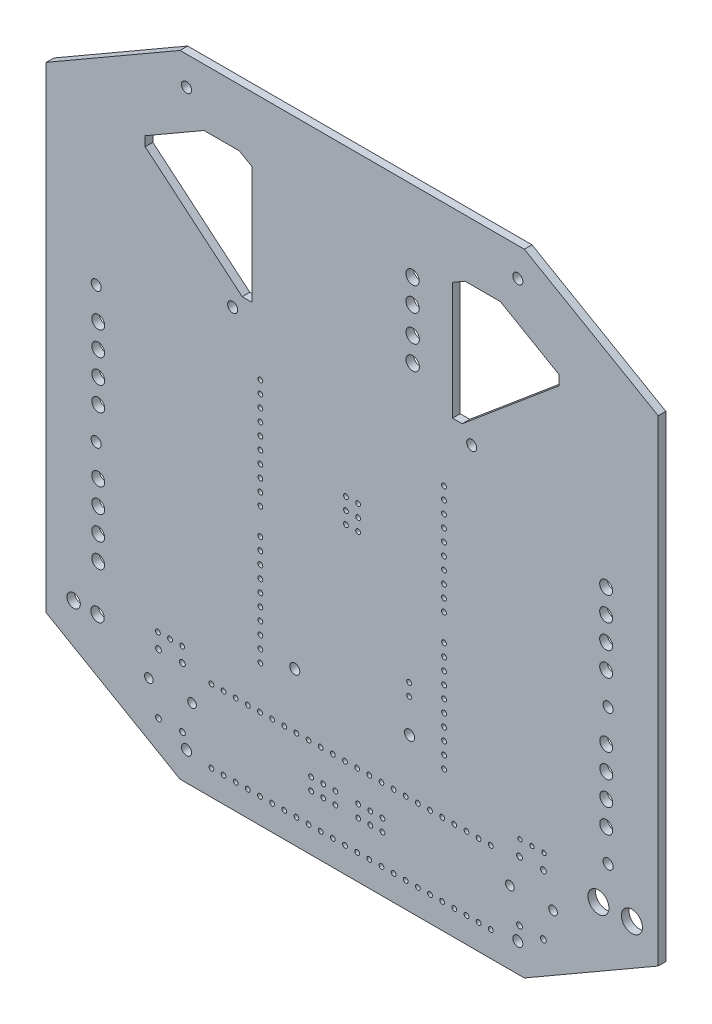
from build123d import *

# Parameters (mm, degrees)
MODEL_R             = 2.2
MODEL_R_2           = 1.4
MODEL_R_3           = 1.35
MODEL_R_4           = 1.05
MODEL_R_5           = 0.9017
MODEL_R_6           = 0.5969
MODEL_R_7           = 0.5
MODEL_R_8           = 0.4445
BOSS_EXTRUDE1_DEPTH = 1.6


with BuildPart() as part:
    # Model → Boss-Extrude1 (new body)
    with BuildSketch(Plane.XY):
        Polygon((-64, -49.834190625), (-36, -66), (36, -66), (64, -49.834190625), (64, 49.834190625), (36, 66), (-36, 66), (-64, 49.834190625), align=None)
        with Locations((58.5, -44.5)):
            Circle(MODEL_R, mode=Mode.SUBTRACT)
        with Locations((51.5, -44.5)):
            Circle(MODEL_R, mode=Mode.SUBTRACT)
        with Locations((12.65, 38.66)):
            Circle(MODEL_R_2, mode=Mode.SUBTRACT)
        with Locations((-58.26, -44.77)):
            Circle(MODEL_R_2, mode=Mode.SUBTRACT)
        with Locations((12.63, 44.24)):
            Circle(MODEL_R_2, mode=Mode.SUBTRACT)
        with Locations((12.63, 49.24)):
            Circle(MODEL_R_2, mode=Mode.SUBTRACT)
        with Locations((-53.26, -44.77)):
            Circle(MODEL_R_2, mode=Mode.SUBTRACT)
        with Locations((12.65, 33.66)):
            Circle(MODEL_R_2, mode=Mode.SUBTRACT)
        with Locations((53.11, 13.33)):
            Circle(MODEL_R_3, mode=Mode.SUBTRACT)
        with Locations((-53.11, -6.73)):
            Circle(MODEL_R_3, mode=Mode.SUBTRACT)
        with Locations((-53.11, -1.73)):
            Circle(MODEL_R_3, mode=Mode.SUBTRACT)
        with Locations((53.13, -15.08)):
            Circle(MODEL_R_3, mode=Mode.SUBTRACT)
        with Locations((-53.11, 3.27)):
            Circle(MODEL_R_3, mode=Mode.SUBTRACT)
        with Locations((-53.11, 8.27)):
            Circle(MODEL_R_3, mode=Mode.SUBTRACT)
        with Locations((53.11, 8.33)):
            Circle(MODEL_R_3, mode=Mode.SUBTRACT)
        with Locations((53.11, 3.33)):
            Circle(MODEL_R_3, mode=Mode.SUBTRACT)
        with Locations((53.11, -1.67)):
            Circle(MODEL_R_3, mode=Mode.SUBTRACT)
        with Locations((-53.11, -35.13)):
            Circle(MODEL_R_3, mode=Mode.SUBTRACT)
        with Locations((-53.11, -30.13)):
            Circle(MODEL_R_3, mode=Mode.SUBTRACT)
        with Locations((-53.11, -20.13)):
            Circle(MODEL_R_3, mode=Mode.SUBTRACT)
        with Locations((53.13, -20.08)):
            Circle(MODEL_R_3, mode=Mode.SUBTRACT)
        with Locations((53.13, -25.08)):
            Circle(MODEL_R_3, mode=Mode.SUBTRACT)
        with Locations((53.13, -30.08)):
            Circle(MODEL_R_3, mode=Mode.SUBTRACT)
        with Locations((-53.11, -25.13)):
            Circle(MODEL_R_3, mode=Mode.SUBTRACT)
        with Locations((-12, -34)):
            Circle(MODEL_R_4, mode=Mode.SUBTRACT)
        with Locations((12, -34)):
            Circle(MODEL_R_4, mode=Mode.SUBTRACT)
        with Locations((-25, 25)):
            Circle(MODEL_R_4, mode=Mode.SUBTRACT)
        with Locations((25, 25)):
            Circle(MODEL_R_4, mode=Mode.SUBTRACT)
        with Locations((-53.53, 14.75)):
            Circle(MODEL_R_4, mode=Mode.SUBTRACT)
        with Locations((53.53, -36.56)):
            Circle(MODEL_R_4, mode=Mode.SUBTRACT)
        with Locations((53.53, -8.15)):
            Circle(MODEL_R_4, mode=Mode.SUBTRACT)
        with Locations((-34.64, -60)):
            Circle(MODEL_R_4, mode=Mode.SUBTRACT)
        with Locations((34.64, -60)):
            Circle(MODEL_R_4, mode=Mode.SUBTRACT)
        with Locations((-34.65, 60)):
            Circle(MODEL_R_4, mode=Mode.SUBTRACT)
        with Locations((34.64, 60)):
            Circle(MODEL_R_4, mode=Mode.SUBTRACT)
        with Locations((-53.54, -13.67)):
            Circle(MODEL_R_4, mode=Mode.SUBTRACT)
        with Locations((-33.4934, -50.9484)):
            Circle(MODEL_R_5, mode=Mode.SUBTRACT)
        with Locations((-42.5104, -50.9484)):
            Circle(MODEL_R_5, mode=Mode.SUBTRACT)
        with Locations((32.9896, -50.7484)):
            Circle(MODEL_R_5, mode=Mode.SUBTRACT)
        with Locations((42.0066, -50.7484)):
            Circle(MODEL_R_5, mode=Mode.SUBTRACT)
        with Locations((40, -44.5)):
            Circle(MODEL_R_6, mode=Mode.SUBTRACT)
        with Locations((-35.5, -44.7)):
            Circle(MODEL_R_6, mode=Mode.SUBTRACT)
        with Locations((34.9962, -44.5)):
            Circle(MODEL_R_6, mode=Mode.SUBTRACT)
        with Locations((-40.5038, -44.7)):
            Circle(MODEL_R_6, mode=Mode.SUBTRACT)
        with Locations((-40.5038, -57.1968)):
            Circle(MODEL_R_6, mode=Mode.SUBTRACT)
        with Locations((-35.5, -57.1968)):
            Circle(MODEL_R_6, mode=Mode.SUBTRACT)
        with Locations((40, -56.9968)):
            Circle(MODEL_R_6, mode=Mode.SUBTRACT)
        with Locations((34.9962, -56.9968)):
            Circle(MODEL_R_6, mode=Mode.SUBTRACT)
        with Locations((6.12, -60.72)):
            Circle(MODEL_R_7, mode=Mode.SUBTRACT)
        with Locations((8.66, -60.72)):
            Circle(MODEL_R_7, mode=Mode.SUBTRACT)
        with Locations((11.2, -60.72)):
            Circle(MODEL_R_7, mode=Mode.SUBTRACT)
        with Locations((13.74, -60.72)):
            Circle(MODEL_R_7, mode=Mode.SUBTRACT)
        with Locations((16.28, -60.72)):
            Circle(MODEL_R_7, mode=Mode.SUBTRACT)
        with Locations((18.82, -60.72)):
            Circle(MODEL_R_7, mode=Mode.SUBTRACT)
        with Locations((21.36, -60.72)):
            Circle(MODEL_R_7, mode=Mode.SUBTRACT)
        with Locations((-6.58, -45.48)):
            Circle(MODEL_R_7, mode=Mode.SUBTRACT)
        with Locations((-11.66, -45.48)):
            Circle(MODEL_R_7, mode=Mode.SUBTRACT)
        with Locations((-14.2, -45.48)):
            Circle(MODEL_R_7, mode=Mode.SUBTRACT)
        with Locations((-16.74, -45.48)):
            Circle(MODEL_R_7, mode=Mode.SUBTRACT)
        with Locations((-19.28, -45.48)):
            Circle(MODEL_R_7, mode=Mode.SUBTRACT)
        with Locations((-21.82, -45.48)):
            Circle(MODEL_R_7, mode=Mode.SUBTRACT)
        with Locations((-24.36, -45.48)):
            Circle(MODEL_R_7, mode=Mode.SUBTRACT)
        with Locations((-26.9, -45.48)):
            Circle(MODEL_R_7, mode=Mode.SUBTRACT)
        with Locations((-29.44, -45.48)):
            Circle(MODEL_R_7, mode=Mode.SUBTRACT)
        with Locations((-9.12, -60.72)):
            Circle(MODEL_R_7, mode=Mode.SUBTRACT)
        with Locations((-11.66, -60.72)):
            Circle(MODEL_R_7, mode=Mode.SUBTRACT)
        with Locations((-14.2, -60.72)):
            Circle(MODEL_R_7, mode=Mode.SUBTRACT)
        with Locations((-16.74, -60.72)):
            Circle(MODEL_R_7, mode=Mode.SUBTRACT)
        with Locations((-19.28, -60.72)):
            Circle(MODEL_R_7, mode=Mode.SUBTRACT)
        with Locations((-21.82, -60.72)):
            Circle(MODEL_R_7, mode=Mode.SUBTRACT)
        with Locations((-24.36, -60.72)):
            Circle(MODEL_R_7, mode=Mode.SUBTRACT)
        with Locations((-26.9, -60.72)):
            Circle(MODEL_R_7, mode=Mode.SUBTRACT)
        with Locations((-29.44, -60.72)):
            Circle(MODEL_R_7, mode=Mode.SUBTRACT)
        with Locations((-9.12, -45.48)):
            Circle(MODEL_R_7, mode=Mode.SUBTRACT)
        with Locations((-6.58, -60.72)):
            Circle(MODEL_R_7, mode=Mode.SUBTRACT)
        with Locations((1.24, 2.54)):
            Circle(MODEL_R_7, mode=Mode.SUBTRACT)
        with Locations((1.24, 0)):
            Circle(MODEL_R_7, mode=Mode.SUBTRACT)
        with Locations((1.24, -2.54)):
            Circle(MODEL_R_7, mode=Mode.SUBTRACT)
        with Locations((-1.3, -2.54)):
            Circle(MODEL_R_7, mode=Mode.SUBTRACT)
        with Locations((-1.3, 0)):
            Circle(MODEL_R_7, mode=Mode.SUBTRACT)
        with Locations((-1.3, 2.54)):
            Circle(MODEL_R_7, mode=Mode.SUBTRACT)
        with Locations((3.58, -60.72)):
            Circle(MODEL_R_7, mode=Mode.SUBTRACT)
        with Locations((26.44, -60.72)):
            Circle(MODEL_R_7, mode=Mode.SUBTRACT)
        with Locations((11.9, -27.04)):
            Circle(MODEL_R_7, mode=Mode.SUBTRACT)
        with Locations((11.9, -24.5)):
            Circle(MODEL_R_7, mode=Mode.SUBTRACT)
        with Locations((-35.55, -41.65)):
            Circle(MODEL_R_7, mode=Mode.SUBTRACT)
        with Locations((-38.09, -41.65)):
            Circle(MODEL_R_7, mode=Mode.SUBTRACT)
        with Locations((-40.63, -41.65)):
            Circle(MODEL_R_7, mode=Mode.SUBTRACT)
        with Locations((28.98, -60.72)):
            Circle(MODEL_R_7, mode=Mode.SUBTRACT)
        with Locations((23.9, -60.72)):
            Circle(MODEL_R_7, mode=Mode.SUBTRACT)
        with Locations((-4.04, -60.72)):
            Circle(MODEL_R_7, mode=Mode.SUBTRACT)
        with Locations((-4.04, -45.48)):
            Circle(MODEL_R_7, mode=Mode.SUBTRACT)
        with Locations((26.44, -45.48)):
            Circle(MODEL_R_7, mode=Mode.SUBTRACT)
        with Locations((-19.2, 14.73)):
            Circle(MODEL_R_7, mode=Mode.SUBTRACT)
        with Locations((-19.2, 12.19)):
            Circle(MODEL_R_7, mode=Mode.SUBTRACT)
        with Locations((-19.2, 9.65)):
            Circle(MODEL_R_7, mode=Mode.SUBTRACT)
        with Locations((-19.2, 7.11)):
            Circle(MODEL_R_7, mode=Mode.SUBTRACT)
        with Locations((-19.2, 4.57)):
            Circle(MODEL_R_7, mode=Mode.SUBTRACT)
        with Locations((-19.2, 2.03)):
            Circle(MODEL_R_7, mode=Mode.SUBTRACT)
        with Locations((-19.2, -0.51)):
            Circle(MODEL_R_7, mode=Mode.SUBTRACT)
        with Locations((-19.2, -3.05)):
            Circle(MODEL_R_7, mode=Mode.SUBTRACT)
        with Locations((-19.2, -5.59)):
            Circle(MODEL_R_7, mode=Mode.SUBTRACT)
        with Locations((-19.2, -8.13)):
            Circle(MODEL_R_7, mode=Mode.SUBTRACT)
        with Locations((23.9, -45.48)):
            Circle(MODEL_R_7, mode=Mode.SUBTRACT)
        with Locations((21.36, -45.48)):
            Circle(MODEL_R_7, mode=Mode.SUBTRACT)
        with Locations((18.82, -45.48)):
            Circle(MODEL_R_7, mode=Mode.SUBTRACT)
        with Locations((16.28, -45.48)):
            Circle(MODEL_R_7, mode=Mode.SUBTRACT)
        with Locations((19.2, -8.13)):
            Circle(MODEL_R_7, mode=Mode.SUBTRACT)
        with Locations((19.2, -5.59)):
            Circle(MODEL_R_7, mode=Mode.SUBTRACT)
        with Locations((19.2, -3.05)):
            Circle(MODEL_R_7, mode=Mode.SUBTRACT)
        with Locations((19.2, -0.51)):
            Circle(MODEL_R_7, mode=Mode.SUBTRACT)
        with Locations((19.2, 2.03)):
            Circle(MODEL_R_7, mode=Mode.SUBTRACT)
        with Locations((19.2, 4.57)):
            Circle(MODEL_R_7, mode=Mode.SUBTRACT)
        with Locations((19.2, 7.11)):
            Circle(MODEL_R_7, mode=Mode.SUBTRACT)
        with Locations((19.2, 9.65)):
            Circle(MODEL_R_7, mode=Mode.SUBTRACT)
        with Locations((19.2, 12.19)):
            Circle(MODEL_R_7, mode=Mode.SUBTRACT)
        with Locations((19.2, 14.73)):
            Circle(MODEL_R_7, mode=Mode.SUBTRACT)
        with Locations((13.74, -45.48)):
            Circle(MODEL_R_7, mode=Mode.SUBTRACT)
        with Locations((11.2, -45.48)):
            Circle(MODEL_R_7, mode=Mode.SUBTRACT)
        with Locations((8.66, -45.48)):
            Circle(MODEL_R_7, mode=Mode.SUBTRACT)
        with Locations((6.12, -45.48)):
            Circle(MODEL_R_7, mode=Mode.SUBTRACT)
        with Locations((-19.2, -13.67)):
            Circle(MODEL_R_7, mode=Mode.SUBTRACT)
        with Locations((-19.2, -16.21)):
            Circle(MODEL_R_7, mode=Mode.SUBTRACT)
        with Locations((-19.2, -18.75)):
            Circle(MODEL_R_7, mode=Mode.SUBTRACT)
        with Locations((-19.2, -21.29)):
            Circle(MODEL_R_7, mode=Mode.SUBTRACT)
        with Locations((-19.2, -23.83)):
            Circle(MODEL_R_7, mode=Mode.SUBTRACT)
        with Locations((-19.2, -26.37)):
            Circle(MODEL_R_7, mode=Mode.SUBTRACT)
        with Locations((-19.2, -28.91)):
            Circle(MODEL_R_7, mode=Mode.SUBTRACT)
        with Locations((-19.2, -31.45)):
            Circle(MODEL_R_7, mode=Mode.SUBTRACT)
        with Locations((-19.2, -33.99)):
            Circle(MODEL_R_7, mode=Mode.SUBTRACT)
        with Locations((-19.2, -36.53)):
            Circle(MODEL_R_7, mode=Mode.SUBTRACT)
        with Locations((28.98, -45.48)):
            Circle(MODEL_R_7, mode=Mode.SUBTRACT)
        with Locations((3.58, -45.48)):
            Circle(MODEL_R_7, mode=Mode.SUBTRACT)
        with Locations((1.04, -45.48)):
            Circle(MODEL_R_7, mode=Mode.SUBTRACT)
        with Locations((-1.5, -45.48)):
            Circle(MODEL_R_7, mode=Mode.SUBTRACT)
        with Locations((19.22, -36.54)):
            Circle(MODEL_R_7, mode=Mode.SUBTRACT)
        with Locations((19.22, -34)):
            Circle(MODEL_R_7, mode=Mode.SUBTRACT)
        with Locations((19.22, -31.46)):
            Circle(MODEL_R_7, mode=Mode.SUBTRACT)
        with Locations((19.22, -28.92)):
            Circle(MODEL_R_7, mode=Mode.SUBTRACT)
        with Locations((19.22, -26.38)):
            Circle(MODEL_R_7, mode=Mode.SUBTRACT)
        with Locations((19.22, -23.84)):
            Circle(MODEL_R_7, mode=Mode.SUBTRACT)
        with Locations((19.22, -21.3)):
            Circle(MODEL_R_7, mode=Mode.SUBTRACT)
        with Locations((19.22, -18.76)):
            Circle(MODEL_R_7, mode=Mode.SUBTRACT)
        with Locations((19.22, -16.22)):
            Circle(MODEL_R_7, mode=Mode.SUBTRACT)
        with Locations((19.22, -13.68)):
            Circle(MODEL_R_7, mode=Mode.SUBTRACT)
        with Locations((-1.5, -60.72)):
            Circle(MODEL_R_7, mode=Mode.SUBTRACT)
        with Locations((1.04, -60.72)):
            Circle(MODEL_R_7, mode=Mode.SUBTRACT)
        with Locations((1.25, -51.86)):
            Circle(MODEL_R_7, mode=Mode.SUBTRACT)
        with Locations((3.79, -51.86)):
            Circle(MODEL_R_7, mode=Mode.SUBTRACT)
        with Locations((6.33, -51.86)):
            Circle(MODEL_R_7, mode=Mode.SUBTRACT)
        with Locations((6.33, -54.4)):
            Circle(MODEL_R_7, mode=Mode.SUBTRACT)
        with Locations((3.79, -54.4)):
            Circle(MODEL_R_7, mode=Mode.SUBTRACT)
        with Locations((1.25, -54.4)):
            Circle(MODEL_R_7, mode=Mode.SUBTRACT)
        with Locations((-8.59, -51.86)):
            Circle(MODEL_R_7, mode=Mode.SUBTRACT)
        with Locations((-6.05, -51.86)):
            Circle(MODEL_R_7, mode=Mode.SUBTRACT)
        with Locations((-3.51, -51.86)):
            Circle(MODEL_R_7, mode=Mode.SUBTRACT)
        with Locations((-3.51, -54.4)):
            Circle(MODEL_R_7, mode=Mode.SUBTRACT)
        with Locations((-6.05, -54.4)):
            Circle(MODEL_R_7, mode=Mode.SUBTRACT)
        with Locations((-8.59, -54.4)):
            Circle(MODEL_R_7, mode=Mode.SUBTRACT)
        with Locations((35.1, -41.3)):
            Circle(MODEL_R_8, mode=Mode.SUBTRACT)
        with Locations((40.1038, -41.3)):
            Circle(MODEL_R_8, mode=Mode.SUBTRACT)
        with Locations((37.5892, -41.3)):
            Circle(MODEL_R_8, mode=Mode.SUBTRACT)
        Polygon((-43.28175, 44.90913125), (-23, 27.89073125), (-21, 27.89073125), (-21, 52.5), (-23.59808125, 54), (-31, 54), (-43.28175, 46.90913125), align=None, mode=Mode.SUBTRACT)
        Polygon((21, 27.89073125), (23, 27.89073125), (43.28175, 44.90913125), (43.28175, 46.90913125), (31, 54), (23.59808125, 54), (21, 52.5), align=None, mode=Mode.SUBTRACT)
    extrude(amount=BOSS_EXTRUDE1_DEPTH)


solid = part.part
